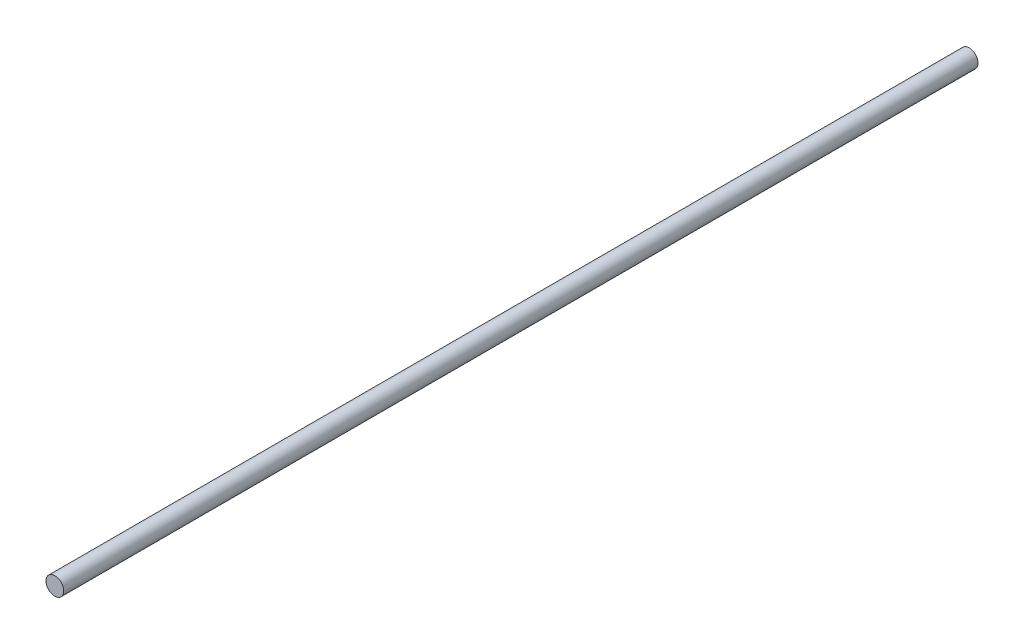
from build123d import *

# Parameters (mm, degrees)
SKETCH1_R           = 1.475
BOSS_EXTRUDE1_DEPTH = 152.24


with BuildPart() as part:
    # Sketch1 → Boss-Extrude1 (new body)
    with BuildSketch(Plane.XY):
        Circle(SKETCH1_R)
    extrude(amount=BOSS_EXTRUDE1_DEPTH)


solid = part.part
